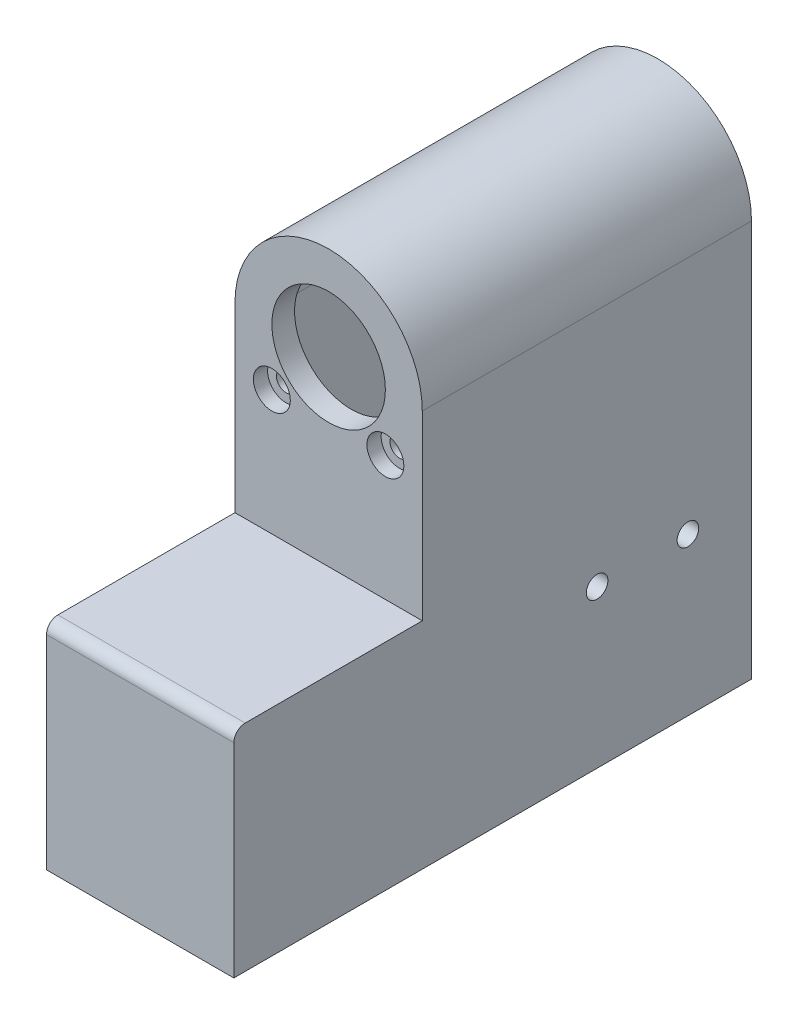
from build123d import *

# Parameters (mm, degrees)
SKETCH1_W           = 4
SKETCH1_H           = 80.5
BOSS_EXTRUDE1_DEPTH = 71
BOSS_EXTRUDE2_START = -4
BOSS_EXTRUDE2_DEPTH = 4
BOSS_EXTRUDE3_DEPTH = 34.2
CUT_EXTRUDE1_DEPTH  = 13
CUT_EXTRUDE2_DEPTH  = 13
SKETCH6_R           = 1.7
CUT_EXTRUDE3_DEPTH  = 13
SKETCH7_R           = 3.25
CUT_EXTRUDE4_DEPTH  = 2.5
BOSS_EXTRUDE4_DEPTH = 44.5
SKETCH10_W          = 46.002383675
SKETCH10_H          = 61.711229379
CUT_EXTRUDE5_DEPTH  = 42
BOSS_EXTRUDE5_DEPTH = 4
CUT_EXTRUDE6_DEPTH  = 10.6
CUT_EXTRUDE7_REACH  = 148.85
SKETCH13_R          = 1.9
SKETCH14_W          = 25
SKETCH14_H          = 33.9
BOSS_EXTRUDE6_DEPTH = 1
CUT_EXTRUDE8_DEPTH  = 15
SKETCH16_W          = 10.4
SKETCH16_H          = 1.3
CUT_EXTRUDE9_DEPTH  = 15
BOSS_EXTRUDE7_DEPTH = 15
SKETCH19_W          = 33
SKETCH19_H          = 37.9
CUT_EXTRUDE10_DEPTH = 1
FILLET1_R           = 2


with BuildPart() as part:
    # Sketch1 → Boss-Extrude1 (new body)
    with BuildSketch(Plane.XY):
        with Locations((2, 40.25)):
            Rectangle(SKETCH1_W, SKETCH1_H)
        with BuildLine():
            Line((0, 80.5), (4, 80.5))
            ThreePointArc((4, 80.5), (16.5, 93), (29, 80.5))
            Line((29, 80.5), (33, 80.5))
            ThreePointArc((33, 80.5), (16.5, 97), (0, 80.5))
        make_face()
        with Locations((31, 40.25)):
            Rectangle(SKETCH1_W, SKETCH1_H)
    extrude(amount=BOSS_EXTRUDE1_DEPTH)

    # Sketch2 → Boss-Extrude2 (add)
    with BuildSketch(Plane.XY.offset(71).offset(BOSS_EXTRUDE2_START)):
        with BuildLine():
            Line((33, 48.5), (0, 48.5))
            Line((0, 48.5), (0, 80.5))
            ThreePointArc((0, 80.5), (16.5, 97), (33, 80.5))
            Line((33, 80.5), (33, 48.5))
        make_face()
    extrude(amount=BOSS_EXTRUDE2_DEPTH)

    # Sketch3 → Boss-Extrude3 (add)
    with BuildSketch(Plane(origin=(0, 0, 67), x_dir=(-1, 0, 0), z_dir=(0, 0, -1))):
        Polygon((-33, 0), (-33, 48.5), (-29, 48.5), (-4, 48.5), (0, 48.5), (0, 0), (-3.837905566, 0), (-4, 44.5), (-29, 44.5), (-29.162094434, 0), align=None)
    extrude(amount=-BOSS_EXTRUDE3_DEPTH)

    # Sketch4 → Cut-Extrude1 (cut)
    with BuildSketch(Plane(origin=(0, 0, 0), x_dir=(-1, 0, 0), z_dir=(0, 0, -1))):
        with BuildLine():
            Line((-4, 80.5), (-4, 0))
            Line((-4, 0), (0, 0))
            Line((0, 0), (0, 80.5))
            ThreePointArc((0, 80.5), (-16.5, 97), (-33, 80.5))
            Line((-33, 80.5), (-33, 0))
            Line((-33, 0), (-29, 0))
            Line((-29, 0), (-29, 80.5))
            ThreePointArc((-29, 80.5), (-16.5, 93), (-4, 80.5))
        make_face()
    extrude(amount=-CUT_EXTRUDE1_DEPTH, mode=Mode.SUBTRACT)

    # Sketch5 → Cut-Extrude2 (cut)
    with BuildSketch(Plane.XY.offset(71)):
        with BuildLine():
            ThreePointArc((26.5, 80.5), (16.5, 90.5), (6.5, 80.5))
            Line((6.5, 80.5), (26.5, 80.5))
        make_face()
        with BuildLine():
            Line((26.5, 80.5), (6.5, 80.5))
            ThreePointArc((6.5, 80.5), (16.5, 70.5), (26.5, 80.5))
        make_face()
    extrude(amount=-CUT_EXTRUDE2_DEPTH, mode=Mode.SUBTRACT)

    # Sketch6 → Cut-Extrude3 (cut)
    with BuildSketch(Plane.XY.offset(71)):
        with Locations((6.5, 70.5)):
            Circle(SKETCH6_R)
        with BuildLine():
            ThreePointArc((28.2, 70.5), (26.5, 72.2), (24.8, 70.5))
            Line((24.8, 70.5), (28.2, 70.5))
        make_face()
        with BuildLine():
            Line((28.2, 70.5), (24.8, 70.5))
            ThreePointArc((24.8, 70.5), (26.5, 68.8), (28.2, 70.5))
        make_face()
    extrude(amount=-CUT_EXTRUDE3_DEPTH, mode=Mode.SUBTRACT)

    # Sketch7 → Cut-Extrude4 (cut)
    with BuildSketch(Plane.XY.offset(71)):
        with Locations((6.5, 70.5)):
            Circle(SKETCH7_R)
        with Locations((26.5, 70.5)):
            Circle(SKETCH7_R)
    extrude(amount=-CUT_EXTRUDE4_DEPTH, mode=Mode.SUBTRACT)

    # Sketch9 → Boss-Extrude4 (add)
    with BuildSketch(Plane.XZ):
        Polygon((29.162094434, 101.2), (29.162094434, 71), (29, 71), (29, 120), align=None)
        Polygon((4, 120), (3.837905566, 101.2), (3.837905566, 71), (4, 71), align=None)
    extrude(amount=-BOSS_EXTRUDE4_DEPTH)

    # Sketch10 → Cut-Extrude5 (cut)
    with BuildSketch(Plane.XY.offset(101.2)):
        with Locations((17.24268837, 24.291112106)):
            Rectangle(SKETCH10_W, SKETCH10_H)
    extrude(amount=CUT_EXTRUDE5_DEPTH, mode=Mode.SUBTRACT)

    # Sketch11 → Boss-Extrude5 (add)
    with BuildSketch(Plane.XY.offset(101.2)):
        Polygon((29, 0), (4, 0), (0, 0), (0, 48.5), (33, 48.5), (33, 0), align=None)
    extrude(amount=BOSS_EXTRUDE5_DEPTH)

    # Sketch12 → Cut-Extrude6 (cut)
    with BuildSketch(Plane.XZ):
        Polygon((4, 13), (4, 101.2), (29, 101.2), (29, 13), (33, 13), (33, 105.2), (0, 105.2), (0, 13), align=None)
    extrude(amount=-CUT_EXTRUDE6_DEPTH, mode=Mode.SUBTRACT)

    # Cut-Extrude7: up to this face of the body (flat: up to its plane)
    cut_extrude7_end = Plane(part.part.faces().sort_by_distance((33, 41.673849147, 53.168159645))[0])
    # Sketch13 → Cut-Extrude7 (cut, up to the picked face)
    with BuildSketch(Plane.ZY, mode=Mode.PRIVATE) as cut_extrude7_sk1:
        with Locations((40.2, 38.3)):
            Circle(SKETCH13_R)
    cut_extrude7_tool1 = split(extrude(cut_extrude7_sk1.sketch, amount=-CUT_EXTRUDE7_REACH, mode=Mode.PRIVATE), bisect_by=cut_extrude7_end, keep=Keep.BOTH, mode=Mode.PRIVATE)
    # Sketch13 → Cut-Extrude7 (cut, up to the picked face)
    with BuildSketch(Plane.ZY, mode=Mode.PRIVATE) as cut_extrude7_sk2:
        with Locations((24.2, 38.3)):
            Circle(SKETCH13_R)
    cut_extrude7_tool2 = split(extrude(cut_extrude7_sk2.sketch, amount=-CUT_EXTRUDE7_REACH, mode=Mode.PRIVATE), bisect_by=cut_extrude7_end, keep=Keep.BOTH, mode=Mode.PRIVATE)
    add(cut_extrude7_tool1.solids().sort_by(Axis((0, 38.3, 40.2), (1, 0, 0)))[0], mode=Mode.SUBTRACT)
    add(cut_extrude7_tool2.solids().sort_by(Axis((0, 38.3, 24.2), (1, 0, 0)))[0], mode=Mode.SUBTRACT)

    # Sketch14 → Boss-Extrude6 (add)
    with BuildSketch(Plane(origin=(0, 0, 101.2), x_dir=(-1, 0, 0), z_dir=(0, 0, -1))):
        with Locations((-16.5, 27.55)):
            Rectangle(SKETCH14_W, SKETCH14_H)
    extrude(amount=BOSS_EXTRUDE6_DEPTH)

    # Sketch15 → Cut-Extrude8 (cut)
    with BuildSketch(Plane.XZ.offset(-10.6)):
        Polygon((26.7, 103.9), (6.3, 103.9), (6.3, 101.5), (16.5, 101.5), (26.7, 101.5), align=None)
    extrude(amount=-CUT_EXTRUDE8_DEPTH, mode=Mode.SUBTRACT)

    # Sketch16 → Cut-Extrude9 (cut)
    with BuildSketch(Plane.XZ.offset(-10.6)):
        with Locations((16.5, 104.55)):
            Rectangle(SKETCH16_W, SKETCH16_H)
    extrude(amount=-CUT_EXTRUDE9_DEPTH, mode=Mode.SUBTRACT)

    # Sketch17 → Boss-Extrude7 (add)
    with BuildSketch(Plane.XZ.offset(-25.6)):
        Polygon((26.7, 103.9), (21.7, 103.9), (21.7, 105.2), (11.3, 105.2), (11.3, 103.9), (6.3, 103.9), (6.3, 101.5), (26.7, 101.5), align=None)
    extrude(amount=BOSS_EXTRUDE7_DEPTH)

    # Sketch19 → Cut-Extrude10 (cut)
    with BuildSketch(Plane.XY.offset(105.2)):
        with Locations((16.5, 29.55)):
            Rectangle(SKETCH19_W, SKETCH19_H)
    extrude(amount=-CUT_EXTRUDE10_DEPTH, mode=Mode.SUBTRACT)

    # Fillet1
    fillet1_edges = [part.edges().sort_by_distance(p)[0] for p in [
        (16.5, 48.5, 104.2),
    ]]
    fillet(fillet1_edges, radius=FILLET1_R)


solid = part.part
